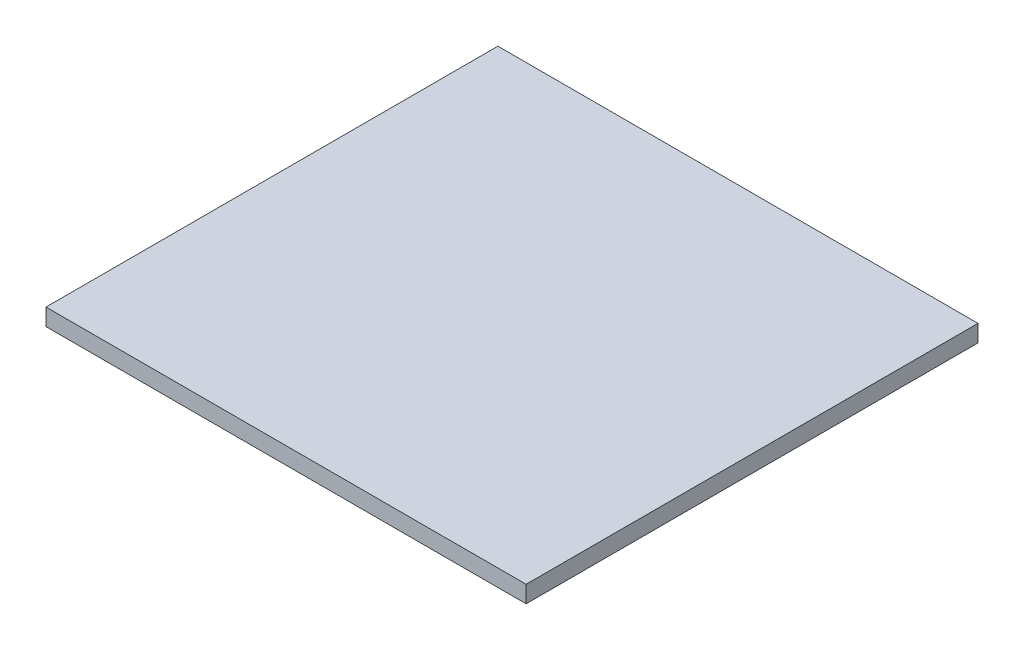
from build123d import *

# Parameters (mm, degrees)
SKETCH1_W           = 85
SKETCH1_H           = 80
BOSS_EXTRUDE1_DEPTH = 3


with BuildPart() as part:
    # Sketch1 → Boss-Extrude1 (new body)
    with BuildSketch(Plane(origin=(0, 0, 0), x_dir=(1, 0, 0), z_dir=(0, 1, 0))):
        Rectangle(SKETCH1_W, SKETCH1_H)
    extrude(amount=BOSS_EXTRUDE1_DEPTH)


solid = part.part
